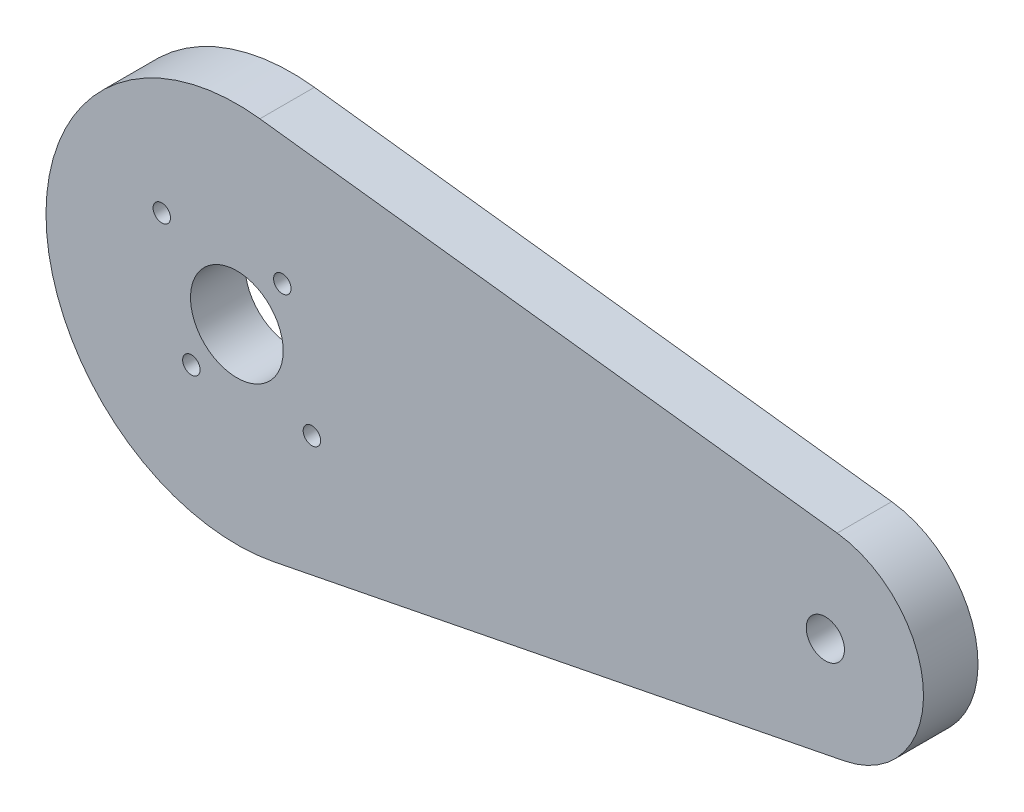
from build123d import *

# Parameters (mm, degrees)
SKETCH1_R           = 1.75
SKETCH1_R_2         = 4.25
SKETCH1_R_3         = 0.8
BOSS_EXTRUDE1_DEPTH = 5


with BuildPart() as part:
    # Sketch1 → Boss-Extrude1 (new body)
    with BuildSketch(Plane.XY):
        with BuildLine():
            Line((34.828288655, 68.520105857), (-18.109200177, 74.952234287))
            ThreePointArc((-18.109200177, 74.952234287), (-37.707923205, 56.929967705), (-16.825342518, 40.41240551))
            Line((-16.825342518, 40.41240551), (35.488558309, 50.756765343))
            ThreePointArc((35.488558309, 50.756765343), (42.736523537, 59.920116261), (34.828288655, 68.520105857))
        make_face()
        with Locations((33.74273446, 59.585813938)):
            Circle(SKETCH1_R, mode=Mode.SUBTRACT)
        with Locations((-20.22, 57.58)):
            Circle(SKETCH1_R_2, mode=Mode.SUBTRACT)
        with Locations((-27.101304543, 62.984641319)):
            Circle(SKETCH1_R_3, mode=Mode.SUBTRACT)
        with Locations((-16.050705268, 62.888434933)):
            Circle(SKETCH1_R_3, mode=Mode.SUBTRACT)
        with Locations((-13.338695457, 52.175358681)):
            Circle(SKETCH1_R_3, mode=Mode.SUBTRACT)
        with Locations((-24.389294732, 52.271565067)):
            Circle(SKETCH1_R_3, mode=Mode.SUBTRACT)
    extrude(amount=-BOSS_EXTRUDE1_DEPTH)


solid = part.part
